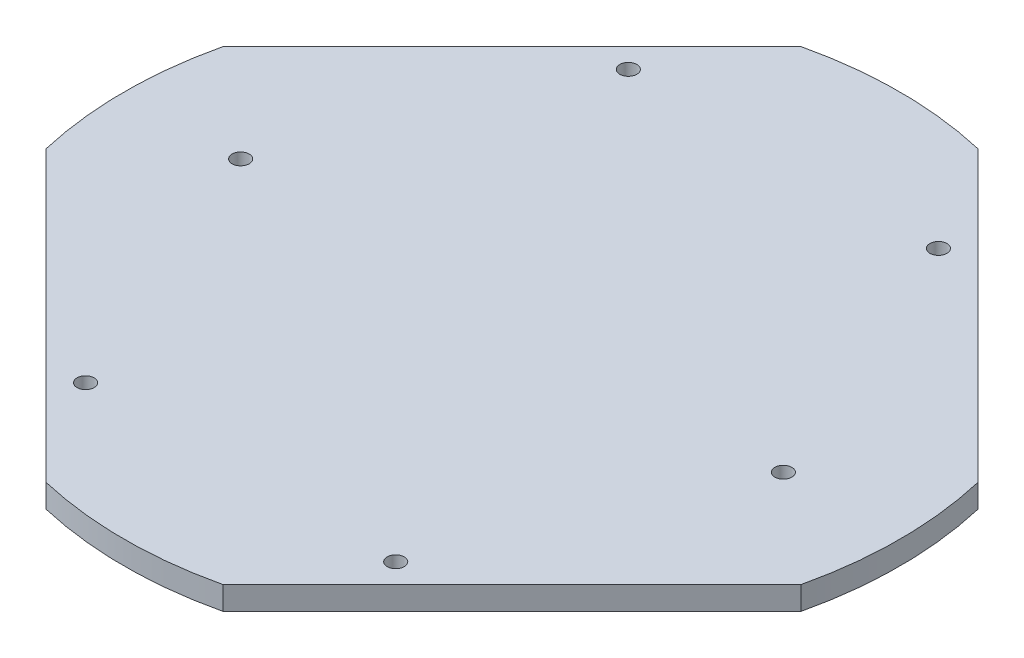
from build123d import *

# Parameters (mm, degrees)
BOSS_EXTRUDE1_DEPTH = 6
SKETCH2_R           = 2.2
CUT_EXTRUDE1_DEPTH  = 142.548578234


with BuildPart() as part:
    # Sketch1 → Boss-Extrude1 (new body)
    with BuildSketch(Plane(origin=(0, 0, 0), x_dir=(1, 0, 0), z_dir=(0, 1, 0))):
        with BuildLine():
            Line((97.353237465, -22.854915336), (22.854915336, -97.353237465))
            ThreePointArc((22.854915336, -97.353237465), (0, -100), (-22.854915336, -97.353237465))
            Line((-22.854915336, -97.353237465), (-97.353237465, -22.854915336))
            ThreePointArc((-97.353237465, -22.854915336), (-100, 0), (-97.353237465, 22.854915336))
            Line((-97.353237465, 22.854915336), (-22.854915336, 97.353237465))
            ThreePointArc((-22.854915336, 97.353237465), (0, 100), (22.854915336, 97.353237465))
            Line((22.854915336, 97.353237465), (97.353237465, 22.854915336))
            ThreePointArc((97.353237465, 22.854915336), (100, 0), (97.353237465, -22.854915336))
        make_face()
    extrude(amount=BOSS_EXTRUDE1_DEPTH)

    # Sketch2 → Cut-Extrude1 (cut, through all)
    with BuildSketch(Plane(origin=(0, 6, 0), x_dir=(1, 0, 0), z_dir=(0, 1, 0))):
        with Locations(Location((-40, -70, 0), (0, 0, 270))):
            Circle(SKETCH2_R)
        with Locations(Location((40, -70, 0), (0, 0, 270))):
            Circle(SKETCH2_R)
        with Locations(Location((40, 70, 0), (0, 0, 270))):
            Circle(SKETCH2_R)
        with Locations(Location((-40, 70, 0), (0, 0, 270))):
            Circle(SKETCH2_R)
        with Locations(Location((-70, 0, 0), (0, 0, 270))):
            Circle(SKETCH2_R)
        with Locations(Location((70, 0, 0), (0, 0, 270))):
            Circle(SKETCH2_R)
    extrude(amount=-CUT_EXTRUDE1_DEPTH, mode=Mode.SUBTRACT)


solid = part.part
